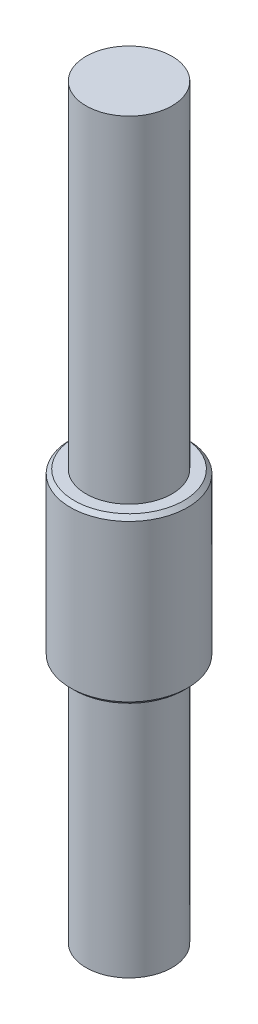
from build123d import *

# Parameters (mm, degrees)
M6X1_0_TAPPED_HOLE1_D     = 5
M6X1_0_TAPPED_HOLE1_DEPTH = 7
M6X1_0_TAPPED_HOLE1_TIP   = 1.502151548


with BuildPart() as part:
    # Sketch1 → Revolve1 (revolve)
    with BuildSketch(Plane.XY, mode=Mode.PRIVATE) as revolve1_sk:
        Polygon((0, 0), (5.5, 0), (5.5, 31.5), (7, 31.5), (7.5, 32), (7.5, 52), (7, 52.5), (5.5, 52.5), (5.5, 95.5), (0, 95.5), align=None)
    revolve(revolve1_sk.sketch.rotate(Axis((0, 0, 0), (0, 1, 0)), 90), axis=Axis((0, 0, 0), (0, 1, 0)))

    # M6x1.0 Tapped Hole1
    with Locations(Plane(origin=(0, 0, 0), x_dir=(-1, 0, 0), z_dir=(0, -1, 0))):
        with Locations((0, 0)):
            Hole(M6X1_0_TAPPED_HOLE1_D / 2, depth=M6X1_0_TAPPED_HOLE1_DEPTH)
            with Locations((0, 0, -(M6X1_0_TAPPED_HOLE1_DEPTH + M6X1_0_TAPPED_HOLE1_TIP / 2))):  # 118° drill point
                Cone(0, M6X1_0_TAPPED_HOLE1_D / 2, M6X1_0_TAPPED_HOLE1_TIP, mode=Mode.SUBTRACT)


solid = part.part
